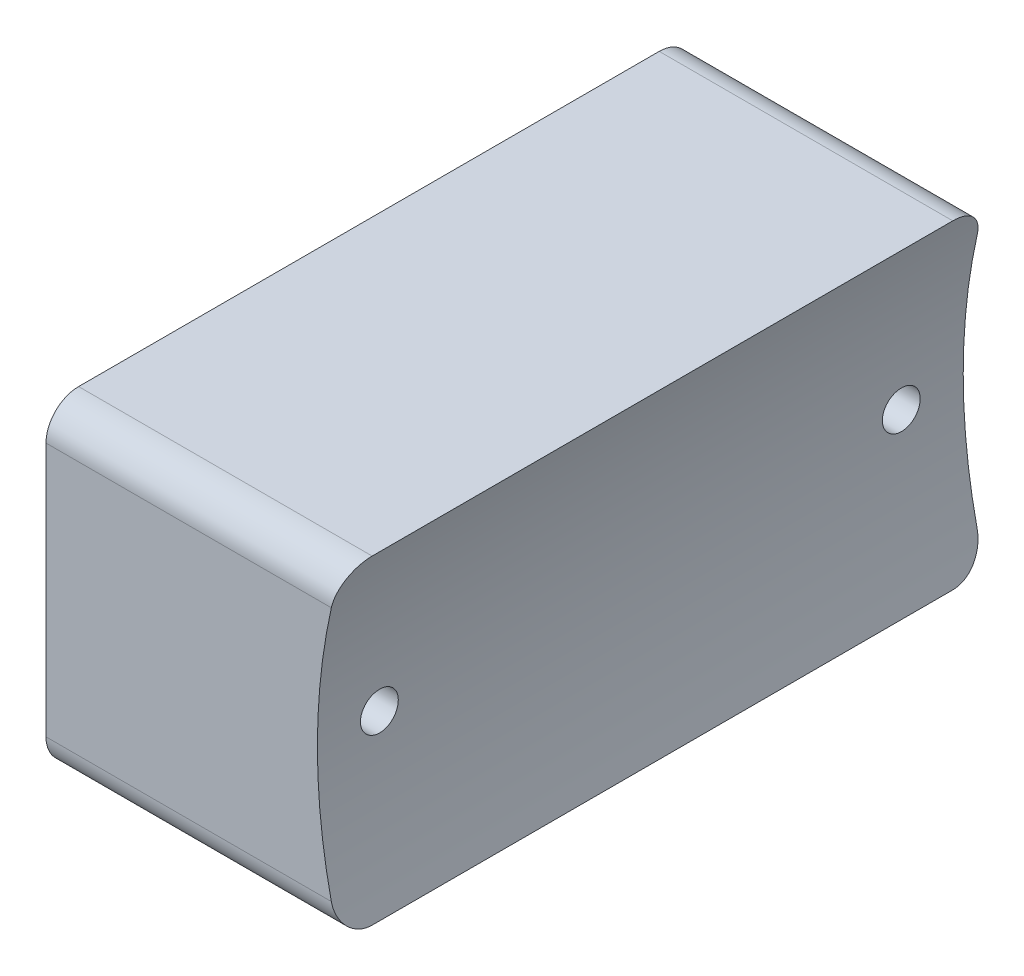
from build123d import *

# Parameters (mm, degrees)
SKETCH_1_W          = 49.5
SKETCH_1_H          = 24.5
EXTRUDE_1_DEPTH     = 22.5
SKETCH_2_R          = 2.5
CUT_EXTRUDE_1_DEPTH = 3
SKETCH_3_W          = 15.2
SKETCH_3_H          = 2.5
CUT_EXTRUDE_2_DEPTH = 8
CUT_EXTRUDE_3_DEPTH = 50
CUT_EXTRUDE_START   = 22.5
SKETCH_5_R          = 1.45
CUT_EXTRUDE_4_DEPTH = 10
FILLET_1_R          = 2.5


with BuildPart() as part:
    # Эскиз1 → Бобышка-Вытянуть1 (new body)
    with BuildSketch(Plane(origin=(0, 0, 0), x_dir=(0, 0, -1), z_dir=(1, 0, 0))):
        Rectangle(SKETCH_1_W, SKETCH_1_H)
    extrude(amount=EXTRUDE_1_DEPTH)

    # Эскиз2 → Вырез-Вытянуть1 (cut)
    with BuildSketch(Plane.ZY):
        with Locations((-20, -7.25)):
            Circle(SKETCH_2_R)
        with Locations((20, -7.25)):
            Circle(SKETCH_2_R)
    extrude(amount=-CUT_EXTRUDE_1_DEPTH, mode=Mode.SUBTRACT)

    # Эскиз3 → Вырез-Вытянуть2 (cut)
    with BuildSketch(Plane.ZY):
        with Locations((0, 4.75)):
            Rectangle(SKETCH_3_W, SKETCH_3_H)
        with Locations((0, 8.75)):
            Rectangle(SKETCH_3_W, SKETCH_3_H)
    extrude(amount=-CUT_EXTRUDE_2_DEPTH, mode=Mode.SUBTRACT)

    # Эскиз4 → Вырез-Вытянуть3 (cut)
    with BuildSketch(Plane(origin=(0, 0, -24.75), x_dir=(-1, 0, 0), z_dir=(0, 0, -1))):
        with BuildLine():
            Line((-22.5, 12.25), (-22.5, -12.25))
            ThreePointArc((-22.5, -12.25), (-20.800548495, 0), (-22.5, 12.25))
        make_face()
    extrude(amount=-CUT_EXTRUDE_3_DEPTH, mode=Mode.SUBTRACT)

    # Эскиз5 → Вырез-Вытянуть4 (cut)
    with BuildSketch(Plane(origin=(0, 0, 0), x_dir=(0, 0, -1), z_dir=(1, 0, 0)).offset(CUT_EXTRUDE_START)):
        with Locations((-20, 0)):
            Circle(SKETCH_5_R)
        with Locations((20, 0)):
            Circle(SKETCH_5_R)
    extrude(amount=-CUT_EXTRUDE_4_DEPTH, mode=Mode.SUBTRACT)

    # Скругление1
    fillet_1_edges = [part.edges().sort_by_distance(p)[0] for p in [
        (11.25, 12.25, -24.75),
        (11.25, -12.25, -24.75),
        (11.25, -12.25, 24.75),
        (11.25, 12.25, 24.75),
    ]]
    fillet(fillet_1_edges, radius=FILLET_1_R)


solid = part.part
